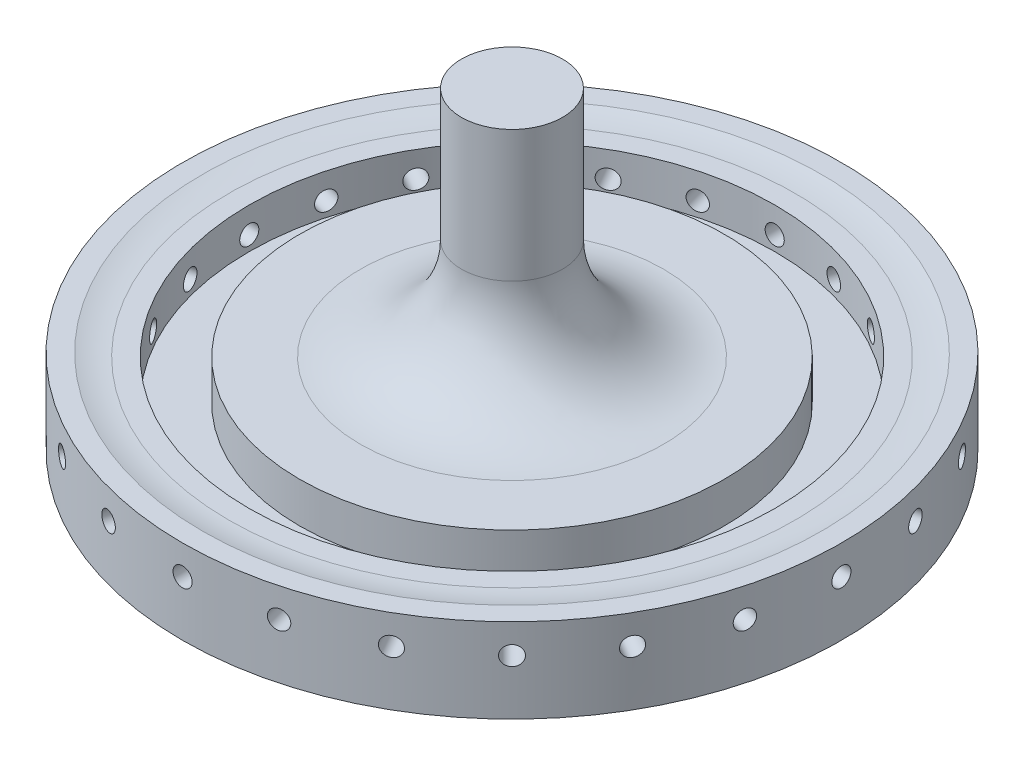
from build123d import *

# Parameters (mm, degrees)
CUT_EXTRUDE1_REACH      = 52.285
CUT_EXTRUDE1_END_RADIUS = 16.51
SKETCH2_R               = 0.6
CIRPATTERN1_COUNT       = 24


with BuildPart() as part:
    # Sketch1 → Revolve1 (revolve)
    with BuildSketch(Plane.XY, mode=Mode.PRIVATE) as revolve1_sk:
        with BuildLine():
            Line((0, 0), (3.175, 0))
            Line((3.175, 0), (3.175, -8.255))
            ThreePointArc((3.175, -8.255), (5.034871939, -12.745128061), (9.525, -14.605))
            Line((9.525, -14.605), (13.335, -14.605))
            Line((13.335, -14.605), (13.335, -17.145))
            Line((13.335, -17.145), (16.51, -17.145))
            Line((16.51, -17.145), (16.51, -14.605))
            Line((16.51, -14.605), (17.78, -14.605))
            ThreePointArc((17.78, -14.605), (18.608841321, -14.55067487), (19.423500936, -14.388628997))
            Line((19.423500936, -14.388628997), (20.693500936, -14.388628997))
            Line((20.693500936, -14.388628997), (20.693500936, -19.685))
            Line((20.693500936, -19.685), (0, -19.685))
            Line((0, -19.685), (0, 0))
        make_face()
    revolve(revolve1_sk.sketch.rotate(Axis((0, 0, 0), (0, -1, 0)), 90), axis=Axis((0, 0, 0), (0, -1, 0)))

    # Cut-Extrude1: up to this cylinder (the profile starts outside it)
    cut_extrude1_end = Plane(origin=(0, -16.2275, 0), z_dir=(0, 1, 0)) * Cylinder(CUT_EXTRUDE1_END_RADIUS, 138.59, mode=Mode.PRIVATE)
    # Sketch2 → Cut-Extrude1 (cut, up to the surface)
    with BuildSketch(Plane.XY.offset(20.693500936), mode=Mode.PRIVATE) as cut_extrude1_sk1:
        with Locations(Location((0, -16.2275, 0), (0, 0, 89.999999951))):
            Circle(SKETCH2_R)
    cut_extrude1_tool1 = extrude(cut_extrude1_sk1.sketch, amount=-CUT_EXTRUDE1_REACH, mode=Mode.PRIVATE) - cut_extrude1_end
    cut_extrude1 = cut_extrude1_tool1.solids().sort_by_distance((0, -16.2275, 20.693501))[0]
    add(cut_extrude1, mode=Mode.SUBTRACT)

    # CirPattern1: Cut-Extrude1 ×24 about axis
    cirpattern1_axis = Axis((0, -14.388628997, 0), (0, 1, 0))
    for i in range(1, CIRPATTERN1_COUNT):
        add(cut_extrude1.rotate(cirpattern1_axis, i * 360 / CIRPATTERN1_COUNT), mode=Mode.SUBTRACT)


solid = part.part
